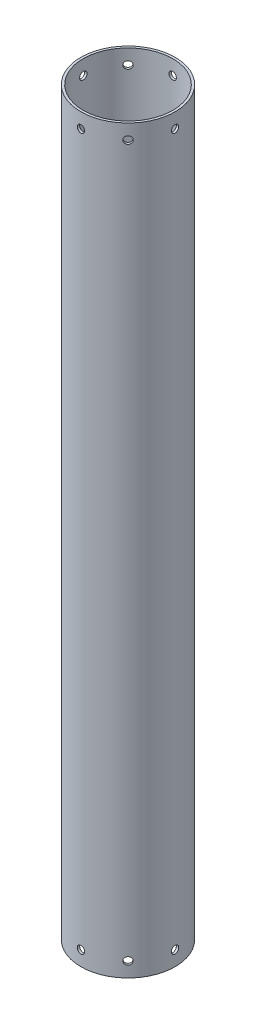
from build123d import *

# Parameters (mm, degrees)
SKETCH1_R               = 31.85
SKETCH1_R_2             = 30.25
EXTRUDE1_DEPTH          = 250
SKETCH2_R               = 2.5
CUT_EXTRUDE1_DEPTH      = 500
CIRPATTERN1_COUNT       = 8
MIRROR1_COPY_1_SKETCH_R = 2.5
MIRROR1_COPY_1_DEPTH    = 500
MIRROR1_COPY_2_SKETCH_R = 2.5
MIRROR1_COPY_2_DEPTH    = 500
MIRROR1_COPY_3_SKETCH_R = 2.5
MIRROR1_COPY_3_DEPTH    = 500
MIRROR1_COPY_4_SKETCH_R = 2.5
MIRROR1_COPY_4_DEPTH    = 500
MIRROR1_COPY_5_SKETCH_R = 2.5
MIRROR1_COPY_5_DEPTH    = 500
MIRROR1_COPY_6_SKETCH_R = 2.5
MIRROR1_COPY_6_DEPTH    = 500
MIRROR1_COPY_7_SKETCH_R = 2.5
MIRROR1_COPY_7_DEPTH    = 500


with BuildPart() as part:
    # Sketch1 → Extrude1 (new body)
    with BuildSketch(Plane(origin=(0, 0, 0), x_dir=(1, 0, 0), z_dir=(0, 1, 0))):
        with Locations(Location((0, 0, 0), (0, 0, 270))):
            Circle(SKETCH1_R)
        with Locations(Location((0, 0, 0), (0, 0, 270))):
            Circle(SKETCH1_R_2, mode=Mode.SUBTRACT)
    extrude1 = extrude(amount=EXTRUDE1_DEPTH)

    # Sketch2 → Cut-Extrude1 (cut)
    with BuildSketch(Plane(origin=(0, 0, 0), x_dir=(0, 0, -1), z_dir=(1, 0, 0))):
        with Locations((0, 10)):
            Circle(SKETCH2_R)
    cut_extrude1 = extrude(amount=-CUT_EXTRUDE1_DEPTH, mode=Mode.SUBTRACT)

    # CirPattern1: Cut-Extrude1 ×8 about axis
    cirpattern1_axis = Axis((0, 250, 0), (0, -1, 0))
    for i in range(1, CIRPATTERN1_COUNT):
        add(cut_extrude1.rotate(cirpattern1_axis, i * 360 / CIRPATTERN1_COUNT), mode=Mode.SUBTRACT)

    # Mirror1: Extrude1, Cut-Extrude1 across plane
    add(extrude1.mirror(Plane.ZX.offset(250)))
    add(cut_extrude1.mirror(Plane.ZX.offset(250)), mode=Mode.SUBTRACT)

    # Mirror1 copy 1 sketch → Mirror1 copy 1 (cut)
    with BuildSketch(Plane(origin=(0, 500, 0), x_dir=(0.7071067811865475, 0, -0.7071067811865476), z_dir=(0.7071067811865476, 0, 0.7071067811865475))):
        with Locations((0, -10)):
            Circle(MIRROR1_COPY_1_SKETCH_R)
    extrude(amount=-MIRROR1_COPY_1_DEPTH, mode=Mode.SUBTRACT)

    # Mirror1 copy 2 sketch → Mirror1 copy 2 (cut)
    with BuildSketch(Plane(origin=(0, 500, 0), x_dir=(1, 0, 0), z_dir=(0, 0, 1))):
        with Locations((0, -10)):
            Circle(MIRROR1_COPY_2_SKETCH_R)
    extrude(amount=-MIRROR1_COPY_2_DEPTH, mode=Mode.SUBTRACT)

    # Mirror1 copy 3 sketch → Mirror1 copy 3 (cut)
    with BuildSketch(Plane(origin=(0, 500, 0), x_dir=(0.7071067811865476, 0, 0.7071067811865475), z_dir=(-0.7071067811865475, 0, 0.7071067811865476))):
        with Locations((0, -10)):
            Circle(MIRROR1_COPY_3_SKETCH_R)
    extrude(amount=-MIRROR1_COPY_3_DEPTH, mode=Mode.SUBTRACT)

    # Mirror1 copy 4 sketch → Mirror1 copy 4 (cut)
    with BuildSketch(Plane(origin=(0, 500, 0), x_dir=(0, 0, 1), z_dir=(-1, 0, 0))):
        with Locations((0, -10)):
            Circle(MIRROR1_COPY_4_SKETCH_R)
    extrude(amount=-MIRROR1_COPY_4_DEPTH, mode=Mode.SUBTRACT)

    # Mirror1 copy 5 sketch → Mirror1 copy 5 (cut)
    with BuildSketch(Plane(origin=(0, 500, 0), x_dir=(-0.7071067811865475, 0, 0.7071067811865477), z_dir=(-0.7071067811865477, 0, -0.7071067811865475))):
        with Locations((0, -10)):
            Circle(MIRROR1_COPY_5_SKETCH_R)
    extrude(amount=-MIRROR1_COPY_5_DEPTH, mode=Mode.SUBTRACT)

    # Mirror1 copy 6 sketch → Mirror1 copy 6 (cut)
    with BuildSketch(Plane(origin=(0, 500, 0), x_dir=(-1, 0, 0), z_dir=(0, 0, -1))):
        with Locations((0, -10)):
            Circle(MIRROR1_COPY_6_SKETCH_R)
    extrude(amount=-MIRROR1_COPY_6_DEPTH, mode=Mode.SUBTRACT)

    # Mirror1 copy 7 sketch → Mirror1 copy 7 (cut)
    with BuildSketch(Plane(origin=(0, 500, 0), x_dir=(-0.7071067811865477, 0, -0.7071067811865474), z_dir=(0.7071067811865474, 0, -0.7071067811865477))):
        with Locations((0, -10)):
            Circle(MIRROR1_COPY_7_SKETCH_R)
    extrude(amount=-MIRROR1_COPY_7_DEPTH, mode=Mode.SUBTRACT)


solid = part.part
